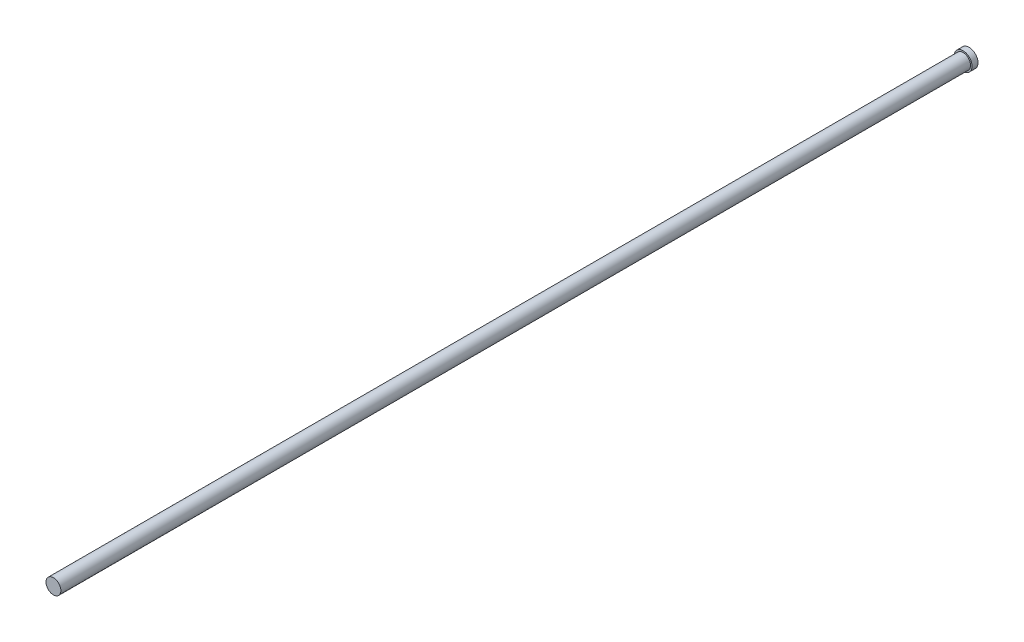
from build123d import *

# Parameters (mm, degrees)
SKETCH2_R           = 2.5
BOSS_EXTRUDE1_DEPTH = 305
SKETCH2_5_R         = 3
BOSS_EXTRUDE2_DEPTH = 2


with BuildPart() as part:
    # Sketch2 → Boss-Extrude1 (new body)
    with BuildSketch(Plane.XY):
        with Locations((-13.086903186, 5.549189199)):
            Circle(SKETCH2_R)
    extrude(amount=BOSS_EXTRUDE1_DEPTH)

    # Sketch2<5> → Boss-Extrude2 (add)
    with BuildSketch(Plane.XY):
        with Locations((-13.087932039, 5.568430377)):
            Circle(SKETCH2_5_R)
    extrude(amount=-BOSS_EXTRUDE2_DEPTH)


solid = part.part
